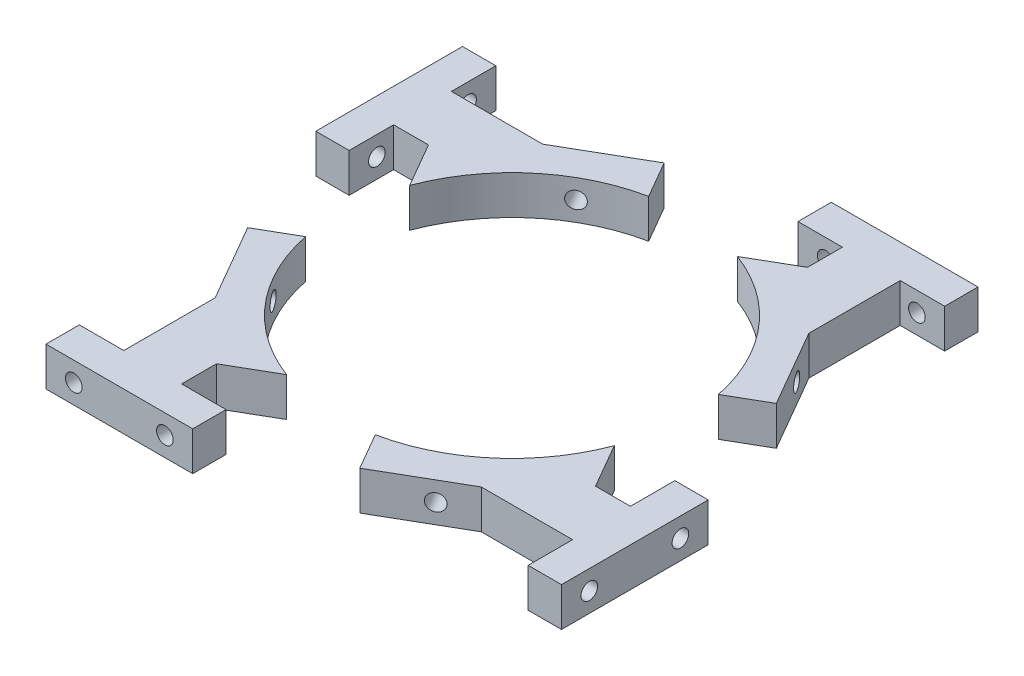
from build123d import *
from build123d.topology import SkipClean

# Parameters (mm, degrees)
SKETCH1_R                            = 31.5
BOSS_EXTRUDE1_DEPTH                  = 3.5
SKETCH2_R                            = 1.5
CUT_EXTRUDE1_DEPTH                   = 4
CIRPATTERN1_COUNT                    = 6
SKETCH3_W                            = 30
SKETCH3_H                            = 7
SKETCH3_R                            = 1.5
BOSS_EXTRUDE2_DEPTH                  = 6
BOSS_EXTRUDE2_DIRECTION_2_REACH      = 77.498
BOSS_EXTRUDE2_DIRECTION_2_END_RADIUS = 31.5
SKETCH6_W                            = 26.400196428
SKETCH6_H                            = 7
SKETCH6_R                            = 1.5
BOSS_EXTRUDE3_DEPTH                  = 6
BOSS_EXTRUDE4_REACH                  = 83.142
SKETCH7_W                            = 10.400196428
SKETCH7_H                            = 7
CIRPATTERN2_COUNT                    = 4


with BuildPart() as part:
    # Sketch1 → Boss-Extrude1 (new, symmetric)
    with BuildSketch(Plane(origin=(0, 0, 0), x_dir=(1, 0, 0), z_dir=(0, 1, 0))):
        Circle(SKETCH1_R)
    extrude(amount=BOSS_EXTRUDE1_DEPTH, both=True)

    # Sketch2 → Cut-Extrude1 (cut)
    with BuildSketch(Plane(origin=(27.279800219, 0, -15.75), x_dir=(-0.499999999999998, 0, -0.8660254037844398), z_dir=(0.8660254037844399, 0, -0.49999999999999806))):
        Circle(SKETCH2_R)
    cut_extrude1 = extrude(amount=-CUT_EXTRUDE1_DEPTH, mode=Mode.SUBTRACT)

    # CirPattern1: Cut-Extrude1 ×6 about axis
    cirpattern1_axis = Axis((0, -3.5, 0), (0, 1, 0))
    for i in range(1, CIRPATTERN1_COUNT):
        add(cut_extrude1.rotate(cirpattern1_axis, i * 360 / CIRPATTERN1_COUNT), mode=Mode.SUBTRACT)


with BuildPart() as body_2:
    # Sketch3 → Boss-Extrude2 (new body)
    with BuildSketch(Plane(origin=(27.279800219, 0, -15.75), x_dir=(-0.499999999999998, 0, -0.8660254037844398), z_dir=(0.8660254037844399, 0, -0.49999999999999806))):
        with Locations((5, 0)):
            Rectangle(SKETCH3_W, SKETCH3_H)
        Circle(SKETCH3_R, mode=Mode.SUBTRACT)
    extrude(amount=BOSS_EXTRUDE2_DEPTH)

    # Boss-Extrude2 direction 2: up to this cylinder (the profile starts outside it)
    with SkipClean():  # the faces are left unmerged after this step: merging them gives an invalid solid
        boss_extrude2_direction_2_end = Plane(origin=(0, 0, 0), z_dir=(0, 1, 0)) * Cylinder(BOSS_EXTRUDE2_DIRECTION_2_END_RADIUS, 218.996, mode=Mode.PRIVATE)
        # Sketch3 → Boss-Extrude2 direction 2 (add, up to the surface)
        with BuildSketch(Plane(origin=(27.279800219, 0, -15.75), x_dir=(-0.499999999999998, 0, -0.8660254037844398), z_dir=(0.8660254037844399, 0, -0.49999999999999806)), mode=Mode.PRIVATE) as boss_extrude2_direction_2_sk1:
            with Locations((5, 0)):
                Rectangle(SKETCH3_W, SKETCH3_H)
            Circle(SKETCH3_R, mode=Mode.SUBTRACT)
        boss_extrude2_direction_2_tool1 = extrude(boss_extrude2_direction_2_sk1.sketch, amount=-BOSS_EXTRUDE2_DIRECTION_2_REACH, mode=Mode.PRIVATE) - boss_extrude2_direction_2_end
        add(boss_extrude2_direction_2_tool1.solids().sort_by_distance((24.692719, 0, -20.230956))[0])
        add(boss_extrude2_direction_2_tool1.solids().sort_by_distance((24.692719, 0, -20.230956))[1])

    # Sketch7 → Boss-Extrude4 (add, up to next)
    with BuildSketch(Plane.XY.offset(-40.383857754), mode=Mode.PRIVATE) as boss_extrude4_sk1:
        with Locations((24.275854428, 0)):
            Rectangle(SKETCH7_W, SKETCH7_H)
    boss_extrude4_tool1 = extrude(boss_extrude4_sk1.sketch, amount=BOSS_EXTRUDE4_REACH, mode=Mode.PRIVATE) - body_2.part


with BuildPart() as body_3:
    # Sketch6 → Boss-Extrude3 (new body)
    with BuildSketch(Plane.XY.offset(-46.383857754)):
        with Locations((24.275854428, 0)):
            Rectangle(SKETCH6_W, SKETCH6_H)
        with Locations((32.475952642, 0)):
            Circle(SKETCH6_R, mode=Mode.SUBTRACT)
        with Locations((16.075756214, 0)):
            Circle(SKETCH6_R, mode=Mode.SUBTRACT)
    extrude(amount=BOSS_EXTRUDE3_DEPTH)


with BuildPart() as body_2_1:
    add(body_2.part)

    add(body_3.part)  # Boss-Extrude4 merges body 3
    add(boss_extrude4_tool1.solids().sort_by_distance((24.275854, 0, -40.383858))[0])


with BuildPart() as cirpattern2_1:
    # CirPattern2: pattern copy
    add(body_2_1.part.rotate(Axis((0, -3.5, 0), (0, 1, 0)), 1 * 360 / CIRPATTERN2_COUNT))


with BuildPart() as cirpattern2_2:
    # CirPattern2: pattern copy
    add(body_2_1.part.rotate(Axis((0, -3.5, 0), (0, 1, 0)), 2 * 360 / CIRPATTERN2_COUNT))


with BuildPart() as cirpattern2_3:
    # CirPattern2: pattern copy
    add(body_2_1.part.rotate(Axis((0, -3.5, 0), (0, 1, 0)), 3 * 360 / CIRPATTERN2_COUNT))


solid = Compound([body_2_1.part, cirpattern2_1.part, cirpattern2_2.part, cirpattern2_3.part])
